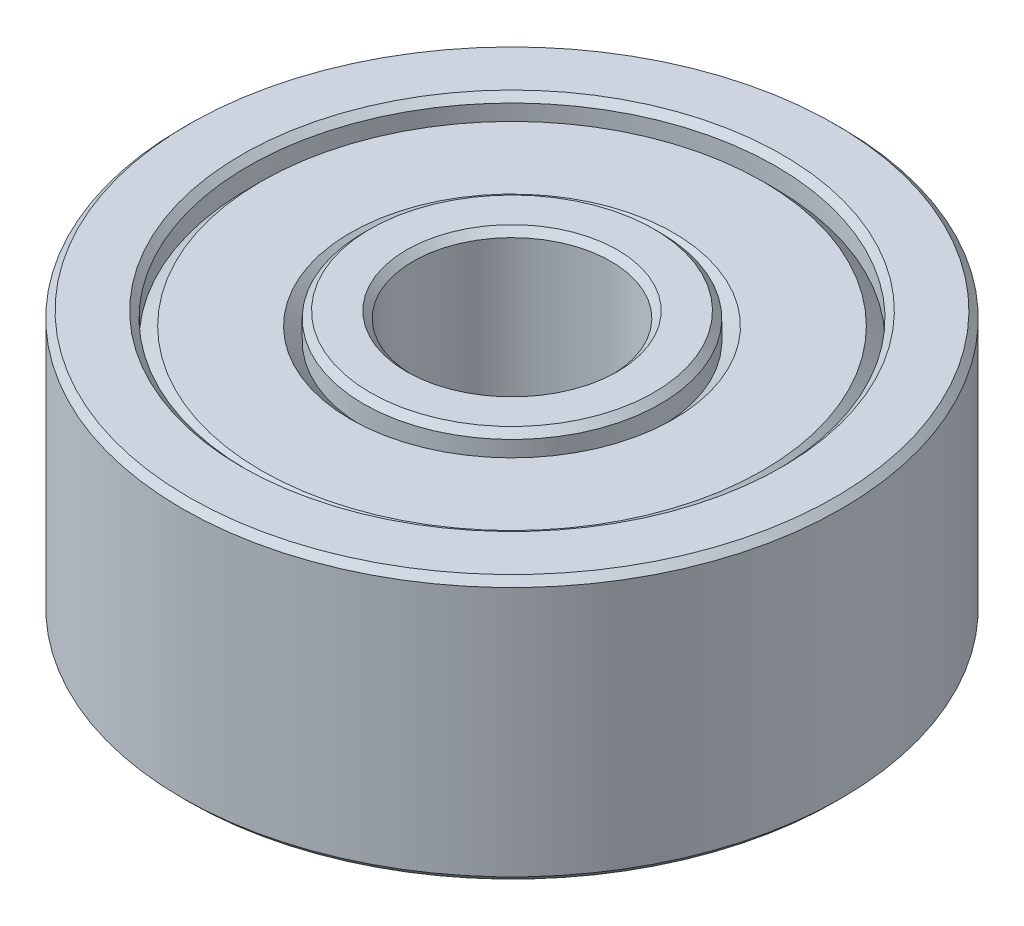
from build123d import *

# Parameters (mm, degrees)
SKETCH1_W     = 3.5
SKETCH1_H     = 4
CHAMFER1_SIZE = 0.1


with BuildPart() as part:
    # Sketch1 → Revolve1 (revolve)
    with BuildSketch(Plane(origin=(0, 0, 0), x_dir=(0, 0, -1), z_dir=(1, 0, 0)), mode=Mode.PRIVATE) as revolve1_sk:
        with Locations((3.25, 0)):
            Rectangle(SKETCH1_W, SKETCH1_H)
    revolve(revolve1_sk.sketch.rotate(Axis((0, 2, 0), (0, -1, 0)), 180), axis=Axis((0, 2, 0), (0, -1, 0)))

    # Sketch3 → Cut-Revolve2 (revolve, cut)
    with BuildSketch(Plane(origin=(0, 0, 0), x_dir=(0, 0, -1), z_dir=(1, 0, 0)), mode=Mode.PRIVATE) as cut_revolve2_sk:
        Polygon((3.8, 1.8), (4, 1.6), (4, 2), (2.25, 2), (2.25, 1.6), (2.45, 1.8), align=None)
    cut_revolve2 = revolve(cut_revolve2_sk.sketch.rotate(Axis((0, 2, 0), (0, -1, 0)), 180), axis=Axis((0, 2, 0), (0, -1, 0)), mode=Mode.SUBTRACT)

    # Mirror1: Cut-Revolve2 across plane
    add(cut_revolve2.mirror(Plane.ZX), mode=Mode.SUBTRACT)

    # Chamfer1
    chamfer1_edges = [part.edges().sort_by_distance(p)[0] for p in [
        (0, 2, -4),
        (0, 2, -2.25),
        (0, -2, -4),
        (0, -2, -2.25),
        (0, 2, -5),
        (0, -2, -5),
        (0, -2, -1.5),
        (0, 2, -1.5),
    ]]
    chamfer(chamfer1_edges, length=CHAMFER1_SIZE)


solid = part.part
